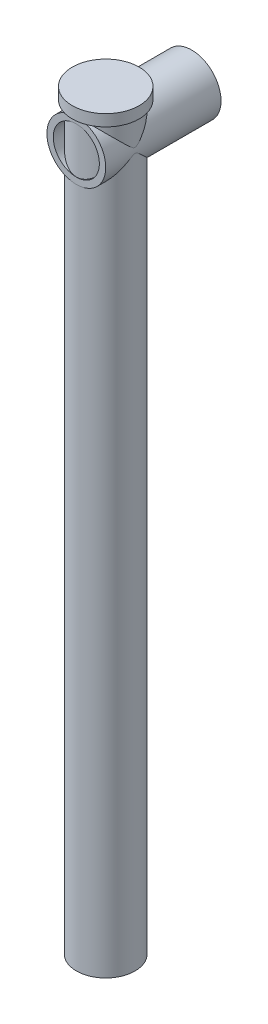
from build123d import *

# Parameters (mm, degrees)
CROQUIS1_R                   = 12.75
CROQUIS1_R_2                 = 10
SALIENTE_EXTRUIR1_DEPTH      = 50
SALIENTE_EXTRUIR2_DEPTH      = 25.4
SALIENTE_EXTRUIR2_DEPTH_BACK = 295.45
CROQUIS2_R                   = 12.7
CORTAR_EXTRUIR1_DEPTH        = 300.922098338
CORTAR_EXTRUIR1_DEPTH_BACK   = 300.922098338
CROQUIS3_R                   = 10
CROQUIS4_R                   = 10
CORTAR_EXTRUIR2_DEPTH        = 42
CROQUIS5_R                   = 14.5
SALIENTE_EXTRUIR4_DEPTH      = 5


with BuildPart() as part:
    # Croquis1 → Saliente-Extruir1 (new body)
    with BuildSketch(Plane.XY):
        Circle(CROQUIS1_R)
        Circle(CROQUIS1_R_2, mode=Mode.SUBTRACT)
    extrude(amount=SALIENTE_EXTRUIR1_DEPTH)

    # Croquis2 → Saliente-Extruir2 (add, two sides: drawn at the far end of the back side and taken through both)
    with BuildSketch(Plane(origin=(0, -12.7, 0), x_dir=(1, 0, 0), z_dir=(0, 1, 0)).offset(-SALIENTE_EXTRUIR2_DEPTH_BACK)):
        with Locations(Location((0, -37.25, 0), (0, 0, 90))):
            Circle(CROQUIS2_R)
    extrude(amount=SALIENTE_EXTRUIR2_DEPTH + SALIENTE_EXTRUIR2_DEPTH_BACK)

    # Croquis3 → Cortar-Extruir1 (cut, two sides: drawn at the far end of the back side and taken through both)
    with BuildSketch(Plane(origin=(0, -12.7, 0), x_dir=(1, 0, 0), z_dir=(0, 1, 0)).offset(-CORTAR_EXTRUIR1_DEPTH_BACK)):
        with Locations(Location((0, -37.25, 0), (0, 0, 83.522954936))):
            Circle(CROQUIS3_R)
    extrude(amount=CORTAR_EXTRUIR1_DEPTH + CORTAR_EXTRUIR1_DEPTH_BACK, mode=Mode.SUBTRACT)

    # Croquis4 → Cortar-Extruir2 (cut)
    with BuildSketch(Plane.XY):
        with Locations(Location((0, 0, 0), (0, 0, 180))):
            Circle(CROQUIS4_R)
    extrude(amount=CORTAR_EXTRUIR2_DEPTH, mode=Mode.SUBTRACT)


with BuildPart() as body_2:
    # Croquis5 → Saliente-Extruir4 (new body)
    with BuildSketch(Plane(origin=(0, 12.7, 0), x_dir=(1, 0, 0), z_dir=(0, 1, 0))):
        with Locations(Location((0, -37.25, 0), (0, 0, 270))):
            Circle(CROQUIS5_R)
    extrude(amount=SALIENTE_EXTRUIR4_DEPTH)


solid = Compound([part.part, body_2.part])
